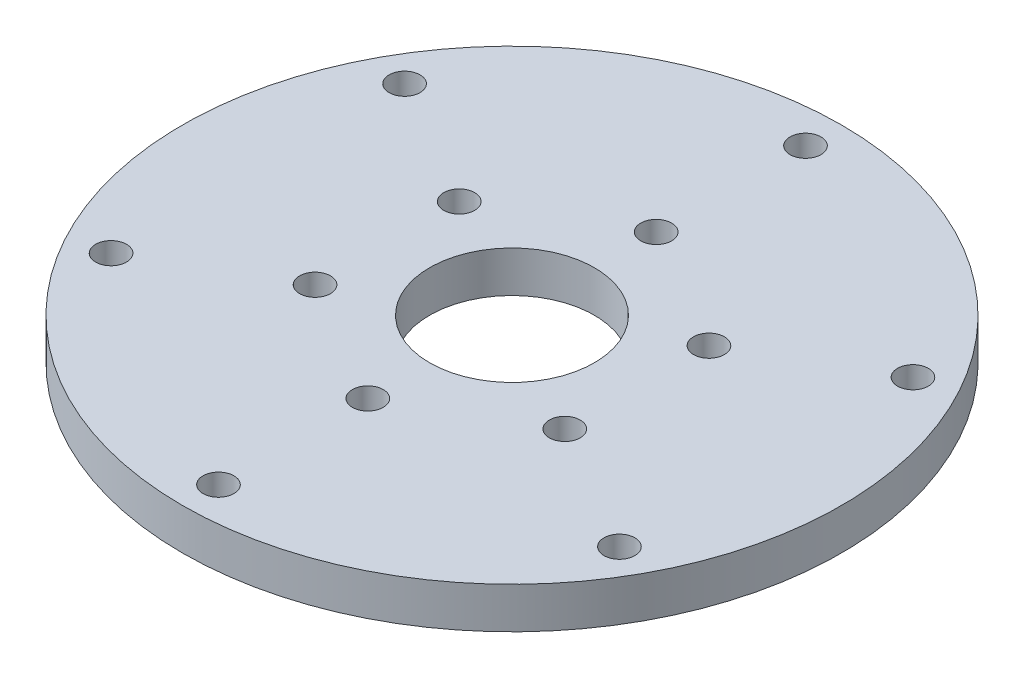
from build123d import *

# Parameters (mm, degrees)
SKETCH_1_R      = 32
SKETCH_1_R_2    = 8
SKETCH_1_R_3    = 1.5
EXTRUDE_1_DEPTH = 4


with BuildPart() as part:
    # 草图1 → 凸台-拉伸1 (new body)
    with BuildSketch(Plane(origin=(0, 0, 0), x_dir=(1, 0, 0), z_dir=(0, 1, 0))):
        Circle(SKETCH_1_R)
        Circle(SKETCH_1_R_2, mode=Mode.SUBTRACT)
        with Locations((0, 14)):
            Circle(SKETCH_1_R_3, mode=Mode.SUBTRACT)
        with Locations((12.124355653, 7)):
            Circle(SKETCH_1_R_3, mode=Mode.SUBTRACT)
        with Locations((12.124355653, -7)):
            Circle(SKETCH_1_R_3, mode=Mode.SUBTRACT)
        with Locations((0, -14)):
            Circle(SKETCH_1_R_3, mode=Mode.SUBTRACT)
        with Locations((0, 28.5)):
            Circle(SKETCH_1_R_3, mode=Mode.SUBTRACT)
        with Locations((24.681724008, 14.25)):
            Circle(SKETCH_1_R_3, mode=Mode.SUBTRACT)
        with Locations((24.681724008, -14.25)):
            Circle(SKETCH_1_R_3, mode=Mode.SUBTRACT)
        with Locations((0, -28.5)):
            Circle(SKETCH_1_R_3, mode=Mode.SUBTRACT)
        with Locations((-24.681724008, -14.25)):
            Circle(SKETCH_1_R_3, mode=Mode.SUBTRACT)
        with Locations((-24.681724008, 14.25)):
            Circle(SKETCH_1_R_3, mode=Mode.SUBTRACT)
        with Locations((-12.124355653, -7)):
            Circle(SKETCH_1_R_3, mode=Mode.SUBTRACT)
        with Locations((-12.124355653, 7)):
            Circle(SKETCH_1_R_3, mode=Mode.SUBTRACT)
    extrude(amount=EXTRUDE_1_DEPTH)


solid = part.part
